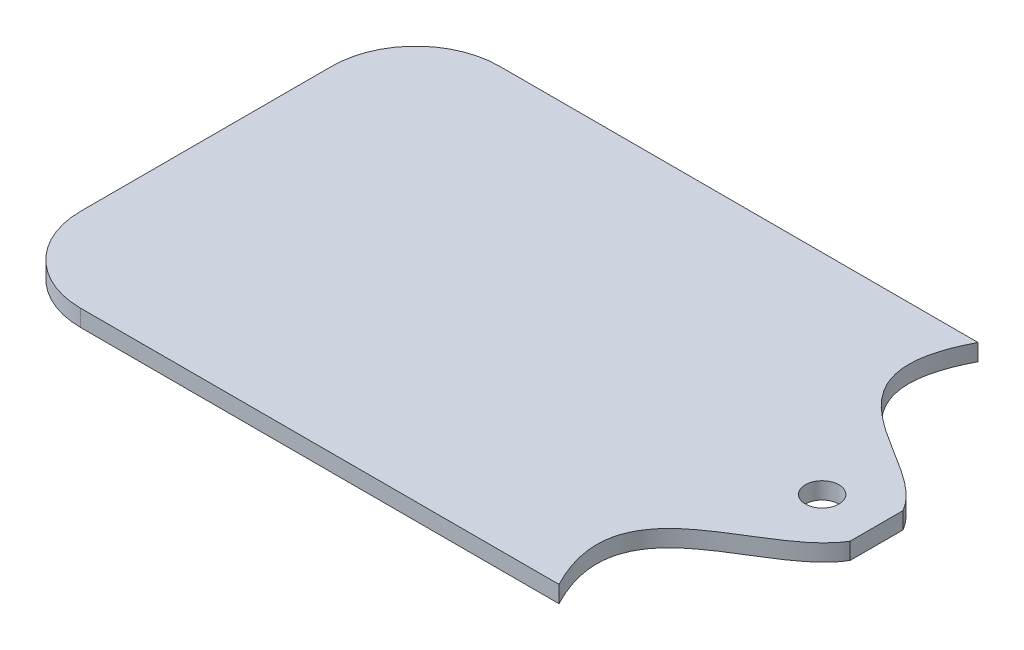
from build123d import *

# Parameters (mm, degrees)
SKETCH1_R           = 20
BOSS_EXTRUDE1_DEPTH = 20
SKETCH2_W           = 60
SKETCH2_H           = 60
BOSS_EXTRUDE2_DEPTH = 20
SKETCH3_R           = 5
CUT_EXTRUDE1_DEPTH  = 20


with BuildPart() as part:
    # Sketch1 → Boss-Extrude1 (new body)
    with BuildSketch(Plane(origin=(0, 0, 0), x_dir=(1, 0, 0), z_dir=(0, 1, 0))):
        with BuildLine():
            Line((-300, 250), (270.987668093, 250))
            add(Edge.make_bspline(
                [(270.987668093, 250), (197.722942543, 110.46504325), (360.729994598, 99.497758331), (400, 31.506674192)],
                knots=[0, 0, 0, 0, 0.79710865, 0.79710865, 0.79710865, 0.79710865], degree=3))
            Line((400, 31.506674192), (400, -31.506674192))
            add(Edge.make_bspline(
                [(270.987668093, -250), (197.722942543, -110.46504325), (360.729994598, -99.497758331), (400, -31.506674192)],
                knots=[0, 0, 0, 0, 0.79710865, 0.79710865, 0.79710865, 0.79710865], degree=3))
            Line((270.987668093, -250), (-300, -250))
            ThreePointArc((-300, -250), (-370.710678119, -220.710678119), (-400, -150))
            Line((-400, -150), (-400, 150))
            ThreePointArc((-400, 150), (-370.710678119, 220.710678119), (-300, 250))
        make_face()
        with Locations(Location((335, 0, 0), (0, 0, 270))):
            Circle(SKETCH1_R, mode=Mode.SUBTRACT)
    extrude(amount=BOSS_EXTRUDE1_DEPTH)

    # Sketch2 → Boss-Extrude2 (add)
    with BuildSketch(Plane.XZ):
        with Locations((-64.506165954, -220)):
            Rectangle(SKETCH2_W, SKETCH2_H)
    extrude(amount=BOSS_EXTRUDE2_DEPTH)

    # Sketch3 → Cut-Extrude1 (cut)
    with BuildSketch(Plane(origin=(0, 0, -250), x_dir=(-1, 0, 0), z_dir=(0, 0, -1))):
        with Locations((64.506165954, 0)):
            Circle(SKETCH3_R)
    extrude(amount=-CUT_EXTRUDE1_DEPTH, mode=Mode.SUBTRACT)


solid = part.part
